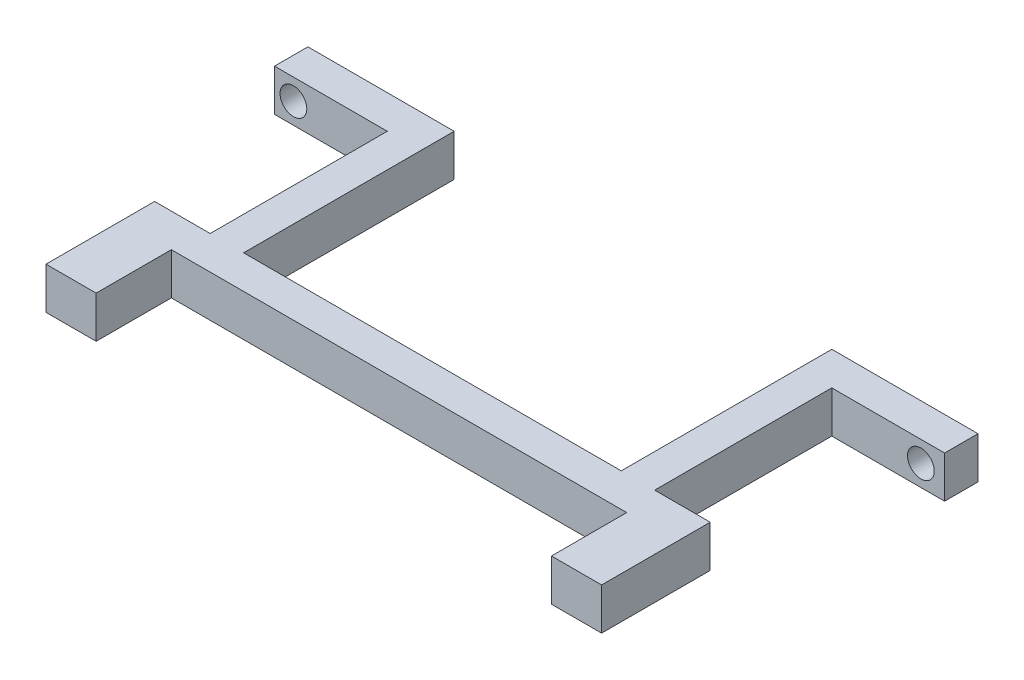
from build123d import *

# Parameters (mm, degrees)
SKETCH1_W            = 50.2
SKETCH1_H            = 5
BOSS_EXTRUDE1_DEPTH  = 26.2
SKETCH2_W            = 45.2
SKETCH2_H            = 23.699783527
CUT_EXTRUDE1_DEPTH   = 26.2
SKETCH4_W            = 1.5
SKETCH4_H            = 24.2
CUT_EXTRUDE2_DEPTH   = 26.2
SKETCH5_W            = 2
SKETCH5_H            = 5
BOSS_EXTRUDE2_DEPTH  = 3
SKETCH7_W            = 1.5
SKETCH7_H            = 24.2
CUT_EXTRUDE3_DEPTH   = 23
SKETCH8_W            = 45.2
SKETCH8_H            = 1.5
CUT_EXTRUDE4_DEPTH   = 23
SKETCH9_W            = 2
SKETCH9_H            = 5
BOSS_EXTRUDE3_DEPTH  = 3
SKETCH11_W           = 2
SKETCH11_H           = 5
BOSS_EXTRUDE4_DEPTH  = 2
SKETCH12_W           = 2
SKETCH12_H           = 4.997290344
BOSS_EXTRUDE5_DEPTH  = 2
SKETCH15_W           = 1
SKETCH15_H           = 5
BOSS_EXTRUDE6_DEPTH  = 4.65
SKETCH16_W           = 1
SKETCH16_H           = 5
BOSS_EXTRUDE7_DEPTH  = 4.65
SKETCH17_W           = 1
SKETCH17_H           = 5
BOSS_EXTRUDE8_DEPTH  = 9
SKETCH18_W           = 1
SKETCH18_H           = 5
BOSS_EXTRUDE9_DEPTH  = 9
SKETCH20_W           = 10
SKETCH20_H           = 5
BOSS_EXTRUDE10_DEPTH = 2
SKETCH21_W           = 10
SKETCH21_H           = 5
BOSS_EXTRUDE11_DEPTH = 2
SKETCH22_W           = 23.2
SKETCH22_H           = 5
BOSS_EXTRUDE12_DEPTH = 3
SKETCH23_W           = 23.2
SKETCH23_H           = 5
BOSS_EXTRUDE13_DEPTH = 3
SKETCH24_W           = 54.5
SKETCH24_H           = 5
BOSS_EXTRUDE14_DEPTH = 3
SKETCH25_W           = 3
SKETCH25_H           = 5
BOSS_EXTRUDE15_DEPTH = 3
SKETCH26_W           = 3
SKETCH26_H           = 5
BOSS_EXTRUDE16_DEPTH = 3
SKETCH27_W           = 13
SKETCH27_H           = 5
BOSS_EXTRUDE17_DEPTH = 3
SKETCH28_W           = 13
SKETCH28_H           = 5
BOSS_EXTRUDE18_DEPTH = 3
SKETCH29_W           = 2
SKETCH29_H           = 5
BOSS_EXTRUDE21_DEPTH = 10
SKETCH30_W           = 2
SKETCH30_H           = 4.997290344
BOSS_EXTRUDE22_DEPTH = 10
SKETCH31_W           = 13.5
SKETCH31_H           = 5
BOSS_EXTRUDE23_DEPTH = 2
SKETCH32_W           = 13.5
SKETCH32_H           = 5
BOSS_EXTRUDE24_DEPTH = 2
SKETCH33_R           = 1.6
CUT_EXTRUDE5_DEPTH   = 12
SKETCH34_R           = 1.6
CUT_EXTRUDE6_DEPTH   = 12


with BuildPart() as part:
    # Sketch1 → Boss-Extrude1 (new body)
    with BuildSketch(Plane.XY):
        with Locations((-66.582634731, 11.968862275)):
            Rectangle(SKETCH1_W, SKETCH1_H)
    extrude(amount=BOSS_EXTRUDE1_DEPTH)

    # Sketch2 → Cut-Extrude1 (cut)
    with BuildSketch(Plane.XZ.offset(-9.468862275)):
        with Locations((-66.582634731, 11.849891764)):
            Rectangle(SKETCH2_W, SKETCH2_H)
    extrude(amount=-CUT_EXTRUDE1_DEPTH, mode=Mode.SUBTRACT)

    # Sketch4 → Cut-Extrude2 (cut)
    with BuildSketch(Plane.XZ.offset(-9.468862275)):
        with Locations((-90.932634731, 14.1)):
            Rectangle(SKETCH4_W, SKETCH4_H)
    extrude(amount=-CUT_EXTRUDE2_DEPTH, mode=Mode.SUBTRACT)

    # Sketch5 → Boss-Extrude2 (add)
    with BuildSketch(Plane.ZY.offset(91.682634731)):
        with Locations((1, 11.968862275)):
            Rectangle(SKETCH5_W, SKETCH5_H)
    extrude(amount=BOSS_EXTRUDE2_DEPTH)

    # Sketch7 → Cut-Extrude3 (cut)
    with BuildSketch(Plane.XZ.offset(-9.468862275)):
        with Locations((-42.232634731, 14.1)):
            Rectangle(SKETCH7_W, SKETCH7_H)
    extrude(amount=-CUT_EXTRUDE3_DEPTH, mode=Mode.SUBTRACT)

    # Sketch8 → Cut-Extrude4 (cut)
    with BuildSketch(Plane.XZ.offset(-9.468862275)):
        with Locations((-66.582634731, 24.449783527)):
            Rectangle(SKETCH8_W, SKETCH8_H)
    extrude(amount=-CUT_EXTRUDE4_DEPTH, mode=Mode.SUBTRACT)

    # Sketch9 → Boss-Extrude3 (add)
    with BuildSketch(Plane(origin=(-41.482634731, 0, 0), x_dir=(0, 0, -1), z_dir=(1, 0, 0))):
        with Locations((-1, 11.968862275)):
            Rectangle(SKETCH9_W, SKETCH9_H)
    extrude(amount=BOSS_EXTRUDE3_DEPTH)

    # Sketch11 → Boss-Extrude4 (add)
    with BuildSketch(Plane(origin=(-38.482634731, 0, 0), x_dir=(0, 0, -1), z_dir=(1, 0, 0))):
        with Locations((-1, 11.968862275)):
            Rectangle(SKETCH11_W, SKETCH11_H)
    extrude(amount=BOSS_EXTRUDE4_DEPTH)

    # Sketch15 → Boss-Extrude6 (add)
    with BuildSketch(Plane.ZY.offset(90.182634731)):
        with Locations((25.7, 11.968862275)):
            Rectangle(SKETCH15_W, SKETCH15_H)
    extrude(amount=BOSS_EXTRUDE6_DEPTH)

    # Sketch16 → Boss-Extrude7 (add)
    with BuildSketch(Plane(origin=(-42.982634731, 0, 0), x_dir=(0, 0, -1), z_dir=(1, 0, 0))):
        with Locations((-25.7, 11.968862275)):
            Rectangle(SKETCH16_W, SKETCH16_H)
    extrude(amount=BOSS_EXTRUDE7_DEPTH)

    # Sketch17 → Boss-Extrude8 (add)
    with BuildSketch(Plane.XY.offset(26.2)):
        with Locations((-38.832634731, 11.968862275)):
            Rectangle(SKETCH17_W, SKETCH17_H)
    extrude(amount=BOSS_EXTRUDE8_DEPTH)

    # Sketch18 → Boss-Extrude9 (add)
    with BuildSketch(Plane.XY.offset(26.2)):
        with Locations((-94.332634731, 11.968862275)):
            Rectangle(SKETCH18_W, SKETCH18_H)
    extrude(amount=BOSS_EXTRUDE9_DEPTH)

    # Sketch20 → Boss-Extrude10 (add)
    with BuildSketch(Plane.ZY.offset(94.832634731)):
        with Locations((30.2, 11.968862275)):
            Rectangle(SKETCH20_W, SKETCH20_H)
    extrude(amount=BOSS_EXTRUDE10_DEPTH)

    # Sketch21 → Boss-Extrude11 (add)
    with BuildSketch(Plane(origin=(-38.332634731, 0, 0), x_dir=(0, 0, -1), z_dir=(1, 0, 0))):
        with Locations((-30.2, 11.968862275)):
            Rectangle(SKETCH21_W, SKETCH21_H)
    extrude(amount=BOSS_EXTRUDE11_DEPTH)

    # Sketch22 → Boss-Extrude12 (add)
    with BuildSketch(Plane.ZY.offset(90.182634731)):
        with Locations((13.6, 11.968862275)):
            Rectangle(SKETCH22_W, SKETCH22_H)
    extrude(amount=BOSS_EXTRUDE12_DEPTH)

    # Sketch23 → Boss-Extrude13 (add)
    with BuildSketch(Plane(origin=(-42.982634731, 0, 0), x_dir=(0, 0, -1), z_dir=(1, 0, 0))):
        with Locations((-13.6, 11.968862275)):
            Rectangle(SKETCH23_W, SKETCH23_H)
    extrude(amount=BOSS_EXTRUDE13_DEPTH)

    # Sketch24 → Boss-Extrude14 (add)
    with BuildSketch(Plane.XY.offset(26.2)):
        with Locations((-66.582634731, 11.968862275)):
            Rectangle(SKETCH24_W, SKETCH24_H)
    extrude(amount=BOSS_EXTRUDE14_DEPTH)

    # Sketch25 → Boss-Extrude15 (add)
    with BuildSketch(Plane.XY.offset(35.2)):
        with Locations((-37.832634731, 11.968862275)):
            Rectangle(SKETCH25_W, SKETCH25_H)
    extrude(amount=BOSS_EXTRUDE15_DEPTH)

    # Sketch26 → Boss-Extrude16 (add)
    with BuildSketch(Plane.XY.offset(35.2)):
        with Locations((-95.332634731, 11.968862275)):
            Rectangle(SKETCH26_W, SKETCH26_H)
    extrude(amount=BOSS_EXTRUDE16_DEPTH)

    # Sketch27 → Boss-Extrude17 (add)
    with BuildSketch(Plane.ZY.offset(96.832634731)):
        with Locations((31.7, 11.968862275)):
            Rectangle(SKETCH27_W, SKETCH27_H)
    extrude(amount=BOSS_EXTRUDE17_DEPTH)

    # Sketch28 → Boss-Extrude18 (add)
    with BuildSketch(Plane(origin=(-36.332634731, 0, 0), x_dir=(0, 0, -1), z_dir=(1, 0, 0))):
        with Locations((-31.7, 11.968862275)):
            Rectangle(SKETCH28_W, SKETCH28_H)
    extrude(amount=BOSS_EXTRUDE18_DEPTH)

    # Sketch29 → Boss-Extrude21 (add)
    with BuildSketch(Plane(origin=(-36.482634731, 0, 0), x_dir=(0, 0, -1), z_dir=(1, 0, 0))):
        with Locations((-1, 11.968862275)):
            Rectangle(SKETCH29_W, SKETCH29_H)
    extrude(amount=BOSS_EXTRUDE21_DEPTH)


with BuildPart() as body_2:
    # Sketch12 → Boss-Extrude5 (new body)
    with BuildSketch(Plane.ZY.offset(94.682634731)):
        with Locations((1, 11.970217103)):
            Rectangle(SKETCH12_W, SKETCH12_H)
    extrude(amount=BOSS_EXTRUDE5_DEPTH)


    add(part.part)  # Boss-Extrude22 merges part
    # Sketch30 → Boss-Extrude22 (add)
    with BuildSketch(Plane.ZY.offset(96.682634731)):
        with Locations((1, 11.970217103)):
            Rectangle(SKETCH30_W, SKETCH30_H)
    extrude(amount=BOSS_EXTRUDE22_DEPTH)

    # Sketch31 → Boss-Extrude23 (add)
    with BuildSketch(Plane.XY.offset(2)):
        with Locations((-99.932634731, 11.968862275)):
            Rectangle(SKETCH31_W, SKETCH31_H)
    extrude(amount=BOSS_EXTRUDE23_DEPTH)

    # Sketch32 → Boss-Extrude24 (add)
    with BuildSketch(Plane.XY.offset(2)):
        with Locations((-33.232634731, 11.968862275)):
            Rectangle(SKETCH32_W, SKETCH32_H)
    extrude(amount=BOSS_EXTRUDE24_DEPTH)

    # Sketch33 → Cut-Extrude5 (cut)
    with BuildSketch(Plane.XY.offset(4)):
        with Locations((-104.419830922, 11.968862275)):
            Circle(SKETCH33_R)
    extrude(amount=-CUT_EXTRUDE5_DEPTH, mode=Mode.SUBTRACT)

    # Sketch34 → Cut-Extrude6 (cut)
    with BuildSketch(Plane.XY.offset(4)):
        with Locations((-29.31902414, 11.968862275)):
            Circle(SKETCH34_R)
    extrude(amount=-CUT_EXTRUDE6_DEPTH, mode=Mode.SUBTRACT)


solid = body_2.part
